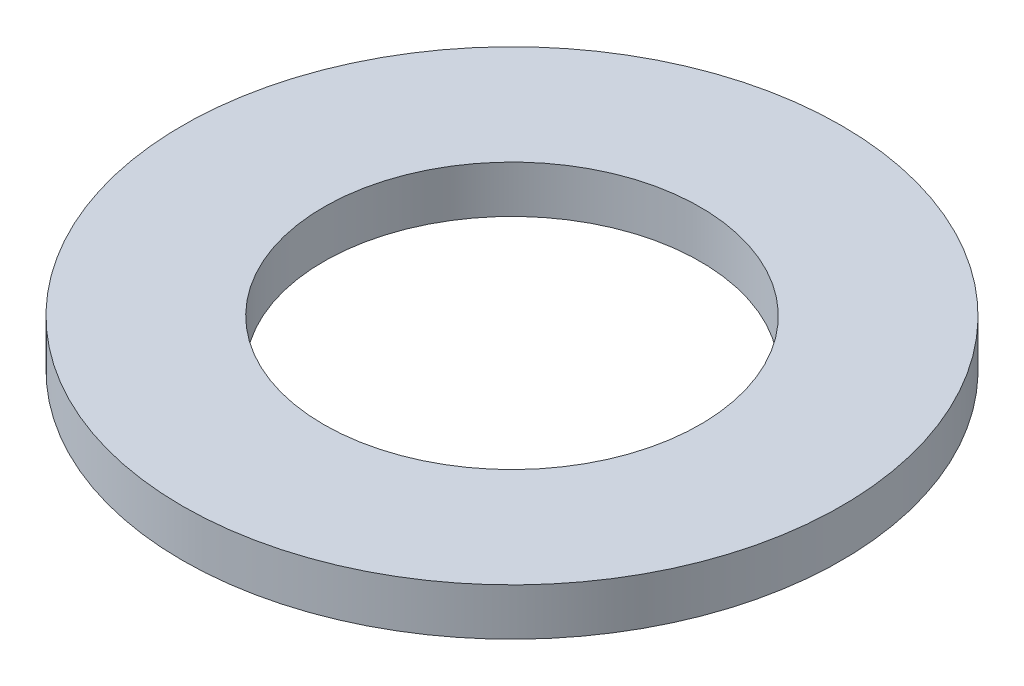
from build123d import *

# Parameters (mm, degrees)
SKETCH1_R           = 11.1125
SKETCH1_R_2         = 6.35
BOSS_EXTRUDE1_DEPTH = 0.79375


with BuildPart() as part:
    # Sketch1 → Boss-Extrude1 (new, symmetric)
    with BuildSketch(Plane(origin=(0, 0, 0), x_dir=(1, 0, 0), z_dir=(0, 1, 0))):
        with Locations(Location((0, 0, 0), (0, 0, 270))):
            Circle(SKETCH1_R)
        with Locations(Location((0, 0, 0), (0, 0, 270))):
            Circle(SKETCH1_R_2, mode=Mode.SUBTRACT)
    extrude(amount=BOSS_EXTRUDE1_DEPTH, both=True)


solid = part.part
